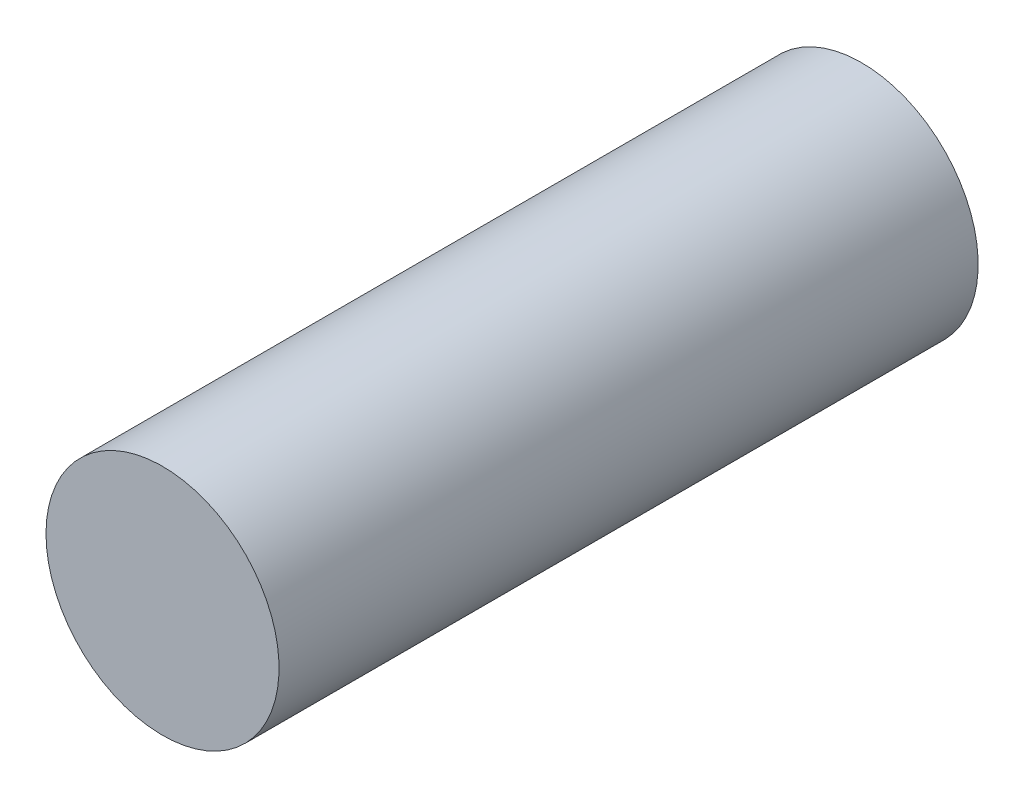
from build123d import *

# Parameters (mm, degrees)
SKETCH1_R           = 3.175
BOSS_EXTRUDE1_DEPTH = 19.05


with BuildPart() as part:
    # Sketch1 → Boss-Extrude1 (new body)
    with BuildSketch(Plane.XY):
        with Locations(Location((0, 0, 0), (0, 0, 180))):
            Circle(SKETCH1_R)
    extrude(amount=BOSS_EXTRUDE1_DEPTH)


solid = part.part
